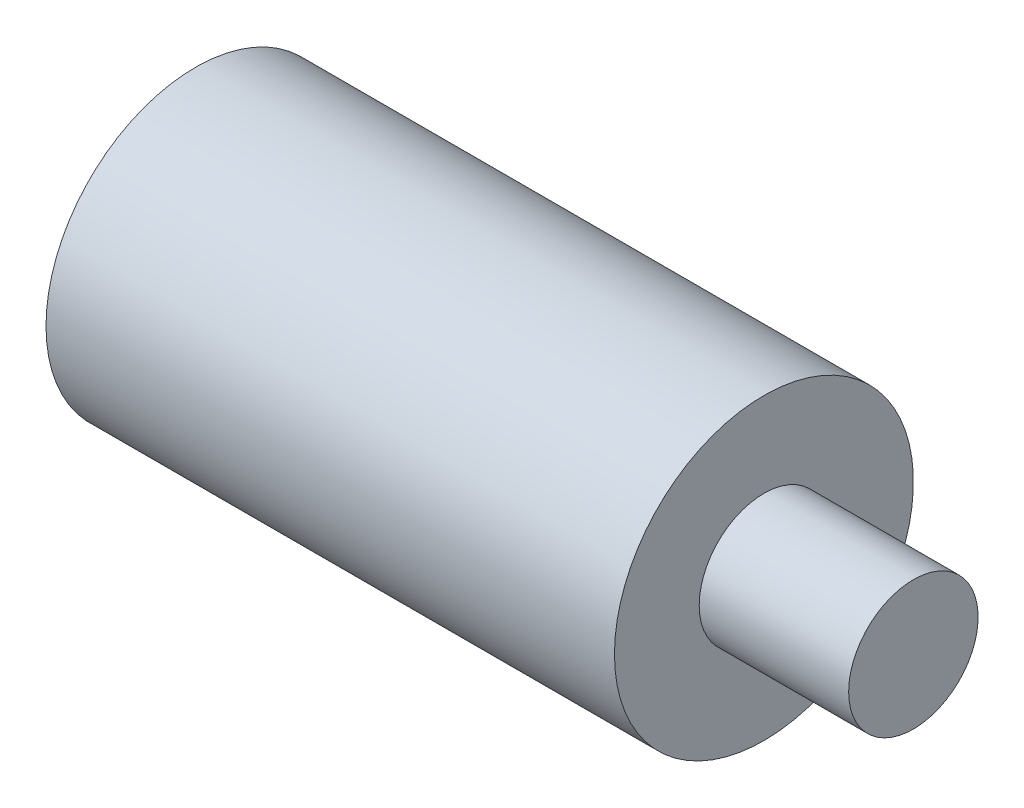
from build123d import *

# Parameters (mm, degrees)
SOCKET_1_SKETCH_W = 15
SOCKET_1_SKETCH_H = 5.5


with BuildPart() as part:
    # CV_Nuvair Sketch → CV_Nuvair (revolve)
    with BuildSketch(Plane.XY):
        Polygon((12.7, 0), (12.7, 5.5), (0, 5.5), (0, 12.7), (-48.3, 12.7), (-48.3, 0), align=None)
    revolve(axis=Axis((-1000, 0, 0), (1, 0, 0)))

    # Socket 1 Sketch → Socket 1 (revolve, cut)
    with BuildSketch(Plane.XY):
        with Locations((-41.8, 2.75)):
            Rectangle(SOCKET_1_SKETCH_W, SOCKET_1_SKETCH_H)
    revolve(axis=Axis((-1000, 0, 0), (1, 0, 0)), mode=Mode.SUBTRACT)


solid = part.part
